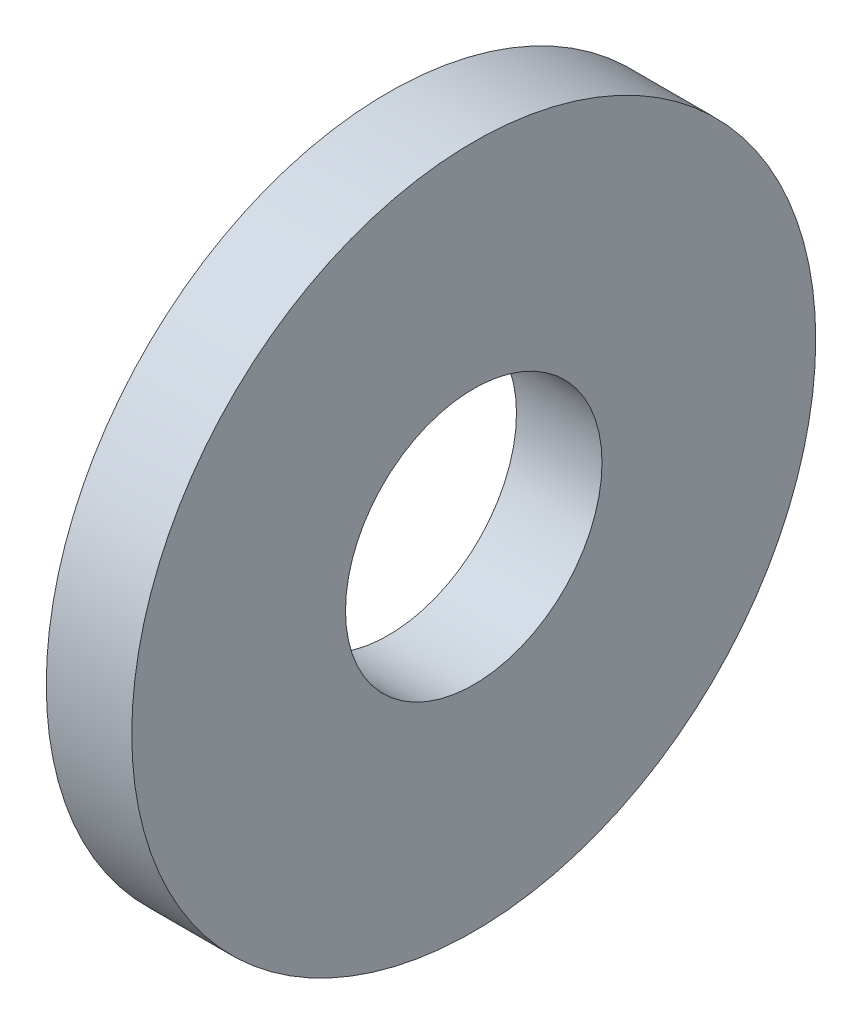
from build123d import *

# Parameters (mm, degrees)
SKETCH1_W = 1
SKETCH1_H = 2.5


with BuildPart() as part:
    # Sketch1 → Revolve1 (revolve)
    with BuildSketch(Plane.XY, mode=Mode.PRIVATE) as revolve1_sk:
        with Locations((0, 2.75)):
            Rectangle(SKETCH1_W, SKETCH1_H)
    revolve(revolve1_sk.sketch.rotate(Axis((0, 0, 0), (1, 0, 0)), 90), axis=Axis((0, 0, 0), (1, 0, 0)))


solid = part.part
